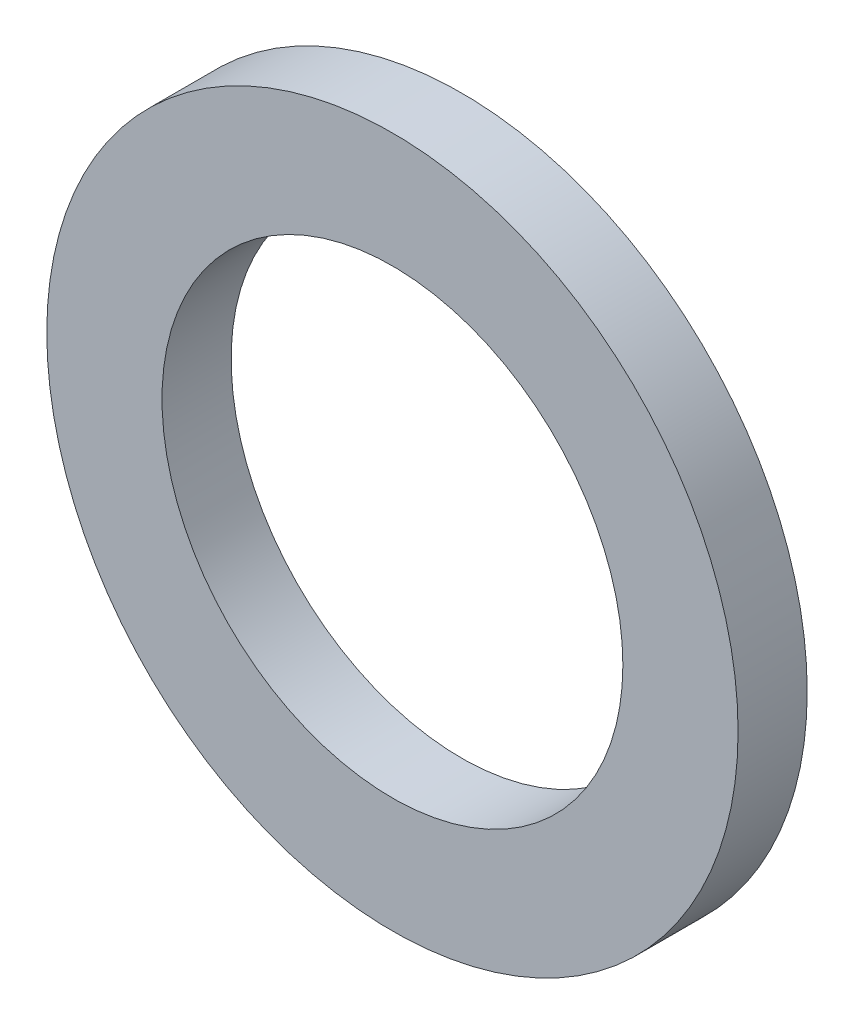
from build123d import *

# Parameters (mm, degrees)
ESQUISSE1_R             = 6
BOSS_EXTRU_1_DEPTH      = 1.2
ESQUISSE2_R             = 4
ENL_V_MAT_EXTRU_1_DEPTH = 1.2


with BuildPart() as part:
    # Esquisse1 → Boss.-Extru.1 (new body)
    with BuildSketch(Plane.XY):
        Circle(ESQUISSE1_R)
    extrude(amount=BOSS_EXTRU_1_DEPTH)

    # Esquisse2 → Enlèv. mat.-Extru.1 (cut)
    with BuildSketch(Plane.XY.offset(1.2)):
        Circle(ESQUISSE2_R)
    extrude(amount=-ENL_V_MAT_EXTRU_1_DEPTH, mode=Mode.SUBTRACT)


solid = part.part
